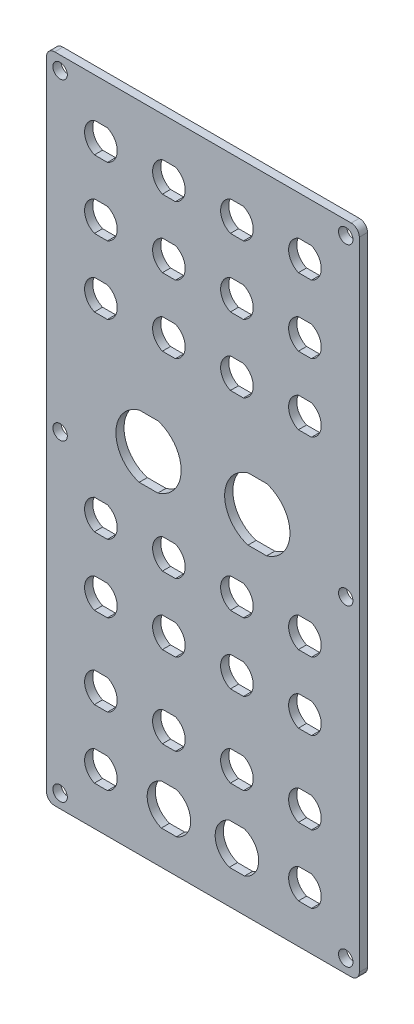
from build123d import *

# Parameters (mm, degrees)
SKETCH1_W            = 115
SKETCH1_H            = 240
BOSS_EXTRUDE1_DEPTH  = 3
CUT_EXTRUDE1_DEPTH   = 3
LPATTERN1_COUNT      = 4
LPATTERN1_PITCH      = 25
LPATTERN1_COUNT_DIR2 = 2
LPATTERN1_PITCH_DIR2 = 25
CUT_EXTRUDE2_DEPTH   = 3
LPATTERN2_COUNT      = 4
LPATTERN2_PITCH      = 25
LPATTERN2_COUNT_DIR2 = 3
LPATTERN2_PITCH_DIR2 = 25
CUT_EXTRUDE3_DEPTH   = 3
CUT_EXTRUDE4_DEPTH   = 3
LPATTERN3_COUNT      = 4
LPATTERN3_PITCH      = 25
LPATTERN3_COUNT_DIR2 = 2
LPATTERN3_PITCH_DIR2 = 25
CUT_EXTRUDE5_DEPTH   = 3
M5_CLEARANCE_HOLE1_D = 5.3
FILLET1_R            = 3


with BuildPart() as part:
    # Sketch1 → Boss-Extrude1 (new body)
    with BuildSketch(Plane.XY):
        with Locations((57.5, 120)):
            Rectangle(SKETCH1_W, SKETCH1_H)
    extrude(amount=BOSS_EXTRUDE1_DEPTH)

    # Sketch2 → Cut-Extrude1 (cut)
    with BuildSketch(Plane.XY.offset(3)):
        with BuildLine():
            Line((22.397915762, 25.5), (17.602084238, 25.5))
            ThreePointArc((17.602084238, 25.5), (14, 20), (17.602084238, 14.5))
            Line((17.602084238, 14.5), (22.397915762, 14.5))
            ThreePointArc((22.397915762, 14.5), (26, 20), (22.397915762, 25.5))
        make_face()
    cut_extrude1 = extrude(amount=-CUT_EXTRUDE1_DEPTH, mode=Mode.SUBTRACT)

    # LPattern1: Cut-Extrude1 4 × 2, 2 skipped
    with Locations(*[(i * LPATTERN1_PITCH, j * LPATTERN1_PITCH_DIR2, 0) for i in range(LPATTERN1_COUNT) for j in range(LPATTERN1_COUNT_DIR2) if (i, j) not in ((0, 0), (1, 0), (2, 0))]):
        add(cut_extrude1, mode=Mode.SUBTRACT)

    # Sketch3 → Cut-Extrude2 (cut)
    with BuildSketch(Plane.XY.offset(3)):
        with BuildLine():
            Line((22.397915762, 214.5), (17.602084238, 214.5))
            ThreePointArc((17.602084238, 214.5), (14, 220), (17.602084238, 225.5))
            Line((17.602084238, 225.5), (22.397915762, 225.5))
            ThreePointArc((22.397915762, 225.5), (26, 220), (22.397915762, 214.5))
        make_face()
    cut_extrude2 = extrude(amount=-CUT_EXTRUDE2_DEPTH, mode=Mode.SUBTRACT)

    # LPattern2: Cut-Extrude2 4 × 3
    with Locations(*[(i * LPATTERN2_PITCH, -j * LPATTERN2_PITCH_DIR2, 0) for i in range(LPATTERN2_COUNT) for j in range(LPATTERN2_COUNT_DIR2) if (i, j) != (0, 0)]):
        add(cut_extrude2, mode=Mode.SUBTRACT)

    # Sketch4 → Cut-Extrude3 (cut)
    with BuildSketch(Plane.XY.offset(3)):
        with BuildLine():
            Line((42.216117819, 27.5), (47.783882181, 27.5))
            ThreePointArc((47.783882181, 27.5), (53, 20), (47.783882181, 12.5))
            Line((47.783882181, 12.5), (42.216117819, 12.5))
            ThreePointArc((42.216117819, 12.5), (37, 20), (42.216117819, 27.5))
        make_face()
    cut_extrude3 = extrude(amount=-CUT_EXTRUDE3_DEPTH, mode=Mode.SUBTRACT)

    # Mirror2: Cut-Extrude3 across plane
    add(cut_extrude3.mirror(Plane.ZY.offset(-57.5)), mode=Mode.SUBTRACT)

    # Sketch5 → Cut-Extrude4 (cut)
    with BuildSketch(Plane.XY.offset(3)):
        with BuildLine():
            Line((22.397915762, 80.5), (17.602084238, 80.5))
            ThreePointArc((17.602084238, 80.5), (14, 75), (17.602084238, 69.5))
            Line((17.602084238, 69.5), (22.397915762, 69.5))
            ThreePointArc((22.397915762, 69.5), (26, 75), (22.397915762, 80.5))
        make_face()
    cut_extrude4 = extrude(amount=-CUT_EXTRUDE4_DEPTH, mode=Mode.SUBTRACT)

    # LPattern3: Cut-Extrude4 4 × 2
    with Locations(*[(i * LPATTERN3_PITCH, j * LPATTERN3_PITCH_DIR2, 0) for i in range(LPATTERN3_COUNT) for j in range(LPATTERN3_COUNT_DIR2) if (i, j) != (0, 0)]):
        add(cut_extrude4, mode=Mode.SUBTRACT)

    # Sketch7 → Cut-Extrude5 (cut)
    with BuildSketch(Plane.XY.offset(3)):
        with BuildLine():
            Line((34.0721727, 141.5), (40.9278273, 141.5))
            ThreePointArc((40.9278273, 141.5), (49.5, 130), (40.9278273, 118.5))
            Line((40.9278273, 118.5), (34.0721727, 118.5))
            ThreePointArc((34.0721727, 118.5), (25.5, 130), (34.0721727, 141.5))
        make_face()
    cut_extrude5 = extrude(amount=-CUT_EXTRUDE5_DEPTH, mode=Mode.SUBTRACT)

    # Mirror3: Cut-Extrude5 across plane
    add(cut_extrude5.mirror(Plane.ZY.offset(-57.5)), mode=Mode.SUBTRACT)

    # M5 Clearance Hole1 (through all)
    with Locations(Plane.XY.offset(3)):
        with Locations((5, 235), (5, 5), (110, 5), (110, 235), (5, 120), (110, 120)):
            Hole(M5_CLEARANCE_HOLE1_D / 2)

    # Fillet1
    fillet1_edges = [part.edges().sort_by_distance(p)[0] for p in [
        (0, 240, 1.5),
        (115, 240, 1.5),
        (115, 0, 1.5),
        (0, 0, 1.5),
    ]]
    fillet(fillet1_edges, radius=FILLET1_R)


solid = part.part
